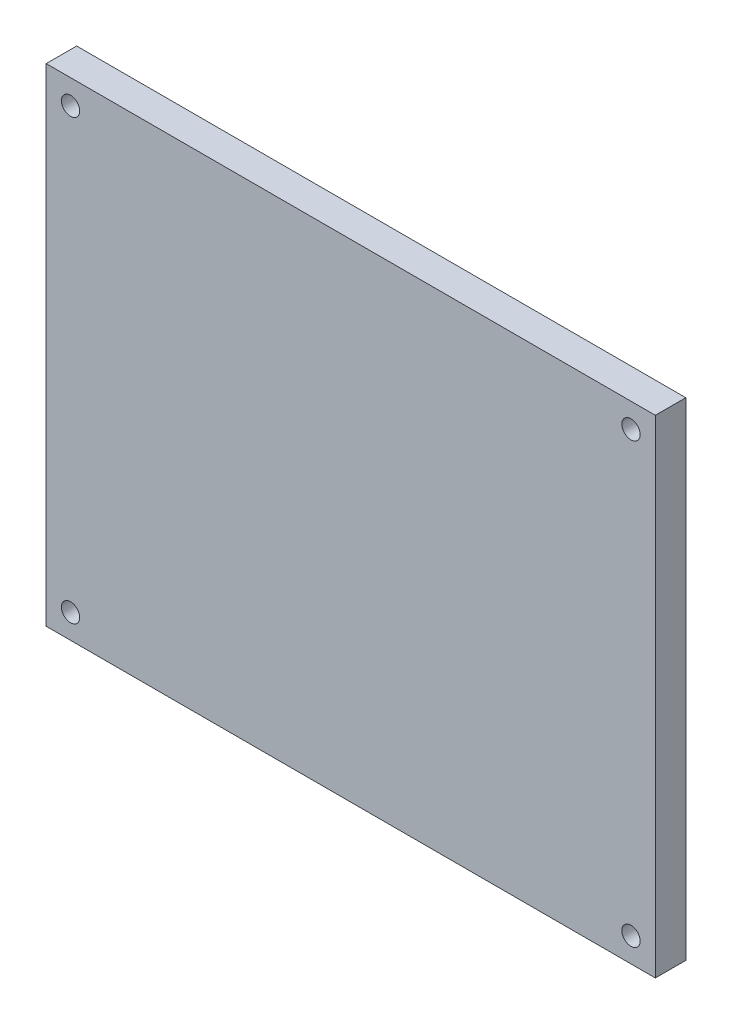
from build123d import *

# Parameters (mm, degrees)
ESQUISSE1_W        = 100
ESQUISSE1_H        = 80
ESQUISSE1_R        = 1.5
BOSS_EXTRU_1_DEPTH = 5


with BuildPart() as part:
    # Esquisse1 → Boss.-Extru.1 (new body)
    with BuildSketch(Plane.XY):
        Rectangle(ESQUISSE1_W, ESQUISSE1_H)
        with Locations((-46, 36)):
            Circle(ESQUISSE1_R, mode=Mode.SUBTRACT)
        with Locations((46, 36)):
            Circle(ESQUISSE1_R, mode=Mode.SUBTRACT)
        with Locations((46, -36)):
            Circle(ESQUISSE1_R, mode=Mode.SUBTRACT)
        with Locations((-46, -36)):
            Circle(ESQUISSE1_R, mode=Mode.SUBTRACT)
    extrude(amount=BOSS_EXTRU_1_DEPTH)


solid = part.part
